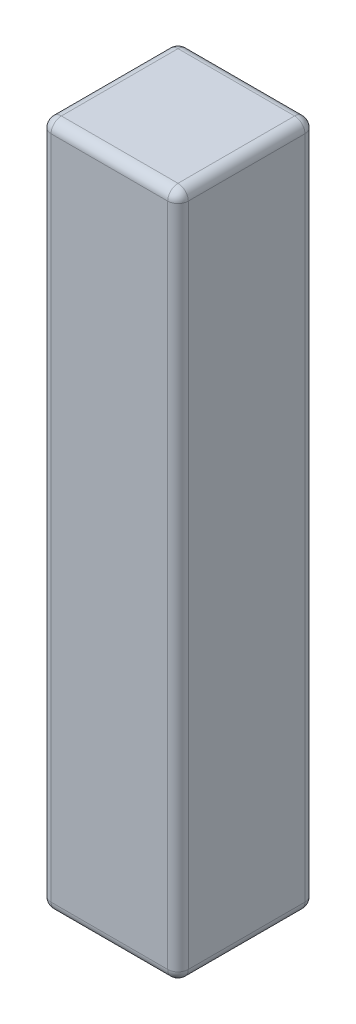
from build123d import *

# Parameters (mm, degrees)
SKETCH1_W      = 2.00000108
SKETCH1_H      = 2.00000108
EXTRUDE2_DEPTH = 5
FILLET2_R      = 0.15


with BuildPart() as part:
    # Sketch1 → Extrude2 (new, symmetric)
    with BuildSketch(Plane(origin=(0, 0, 0), x_dir=(1, 0, 0), z_dir=(0, 1, 0))):
        Rectangle(SKETCH1_W, SKETCH1_H)
    extrude(amount=EXTRUDE2_DEPTH, both=True)

    # Fillet2
    fillet2_edges = [part.edges().sort_by_distance(p)[0] for p in [
        (1.00000054, 5, 0),
        (0, 5, -1.00000054),
        (-1.00000054, 5, 0),
        (0, -5, -1.00000054),
        (1.00000054, -5, 0),
        (0, -5, 1.00000054),
        (-1.00000054, -5, 0),
        (0, 5, 1.00000054),
        (-1.00000054, 0, -1.00000054),
        (1.00000054, 0, -1.00000054),
        (1.00000054, 0, 1.00000054),
        (-1.00000054, 0, 1.00000054),
    ]]
    fillet(fillet2_edges, radius=FILLET2_R)


solid = part.part
